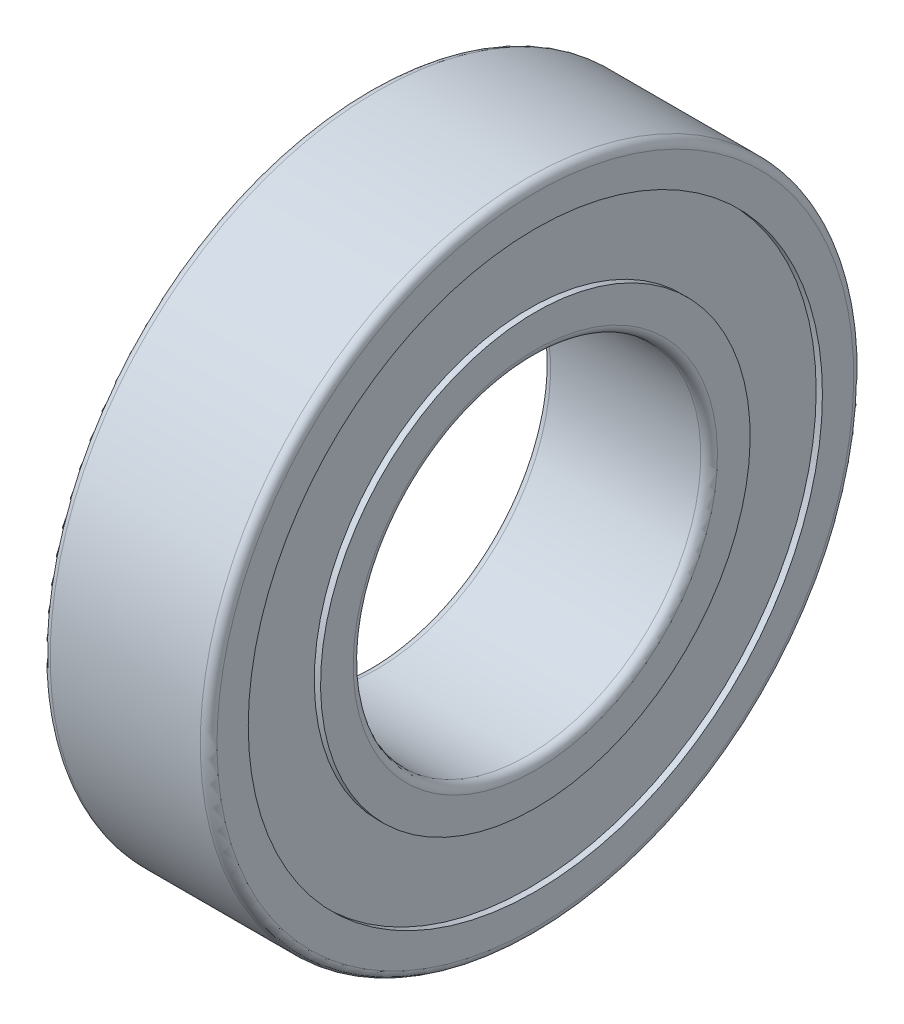
from build123d import *

# Parameters (mm, degrees)
FILLET1_R = 0.6


with BuildPart() as part:
    # Sketch1 → Revolve1 (revolve)
    with BuildSketch(Plane.XY, mode=Mode.PRIVATE) as revolve1_sk:
        Polygon((0, 12.5), (0, 15.45), (0.45, 15.45), (0.45, 20.65), (0, 20.65), (0, 23.5), (12, 23.5), (12, 20.65), (11.55, 20.65), (11.55, 15.45), (12, 15.45), (12, 12.5), align=None)
    revolve(revolve1_sk.sketch.rotate(Axis((0, 0, 0), (1, 0, 0)), 180), axis=Axis((0, 0, 0), (1, 0, 0)))

    # Fillet1
    fillet1_edges = [part.edges().sort_by_distance(p)[0] for p in [
        (12, 23.5, 0),
        (0, 23.5, 0),
        (0, 12.5, 0),
        (12, 12.5, 0),
    ]]
    fillet(fillet1_edges, radius=FILLET1_R)


solid = part.part
